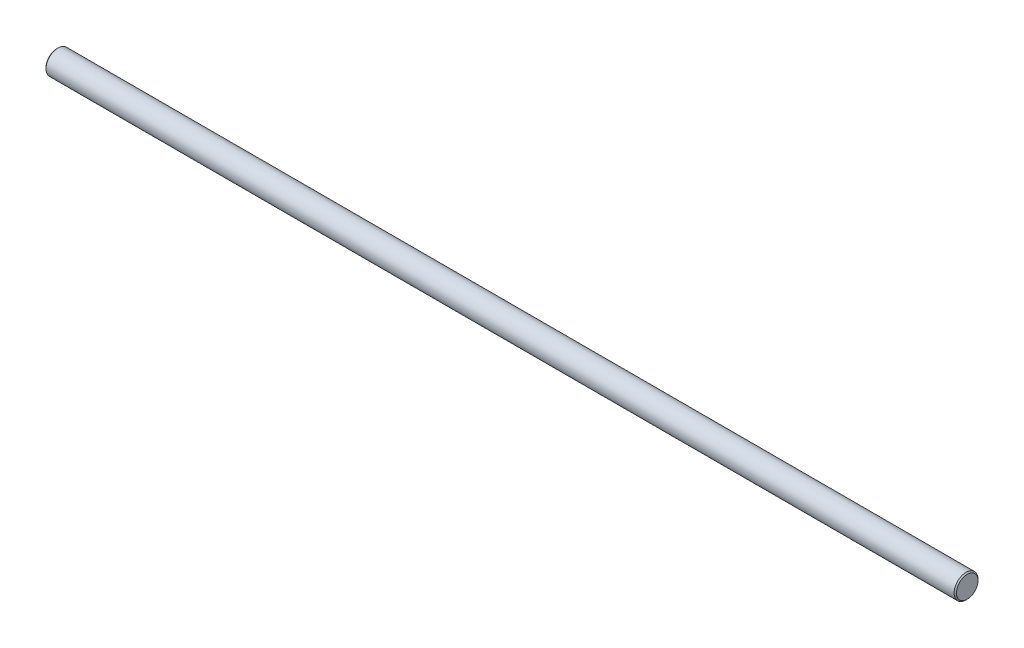
from build123d import *


with BuildPart() as part:
    # Sketch1 → Revolve1 (revolve)
    with BuildSketch(Plane.XY, mode=Mode.PRIVATE) as revolve1_sk:
        Polygon((0, 0), (0, 4.5), (0.5, 5), (379.5, 5), (380, 4.5), (380, 0), align=None)
    revolve(revolve1_sk.sketch.rotate(Axis((380, 0, 0), (-1, 0, 0)), 270), axis=Axis((380, 0, 0), (-1, 0, 0)))


solid = part.part
